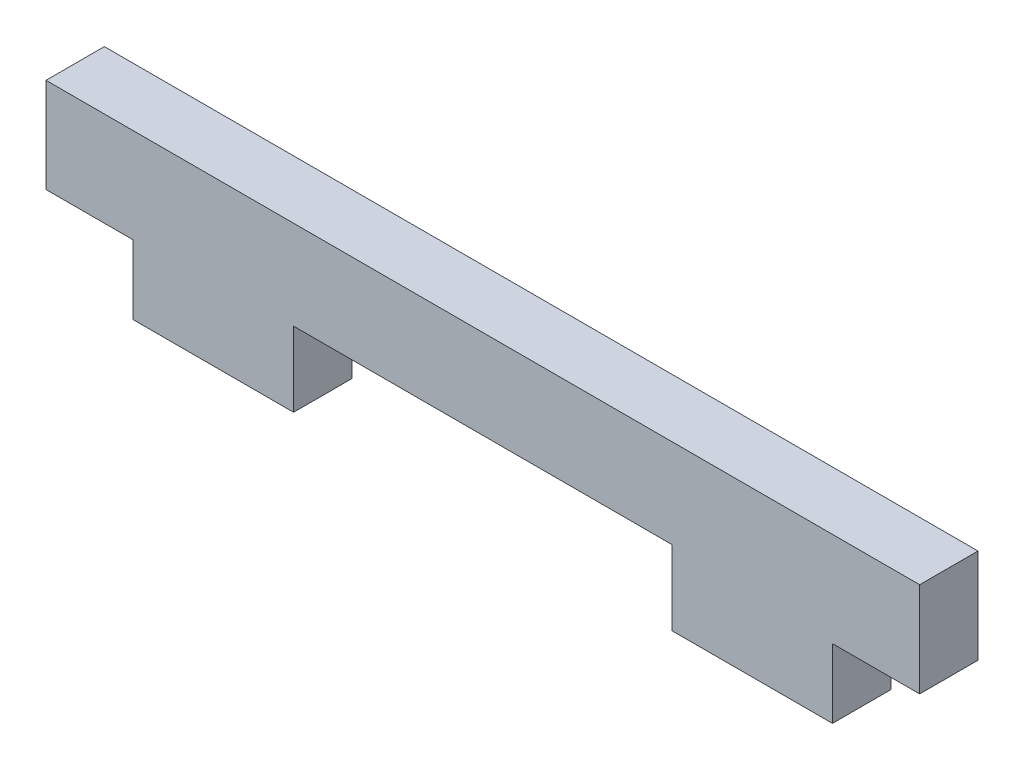
from build123d import *

# Parameters (mm, degrees)
BOSS_EXTRUDE1_DEPTH = 3.7


with BuildPart() as part:
    # Sketch1 → Boss-Extrude1 (new body)
    with BuildSketch(Plane.XY):
        Polygon((-21.693712593, 0), (33.706287407, 0), (33.706287407, -6), (28.176287407, -6), (28.176287407, -10.381805668), (18.006287407, -10.381805668), (18.006287407, -5.65013307), (-5.993712593, -5.65013307), (-5.993712593, -10.381805668), (-16.163712593, -10.381805668), (-16.163712593, -6), (-21.693712593, -6), align=None)
    extrude(amount=BOSS_EXTRUDE1_DEPTH)


solid = part.part
